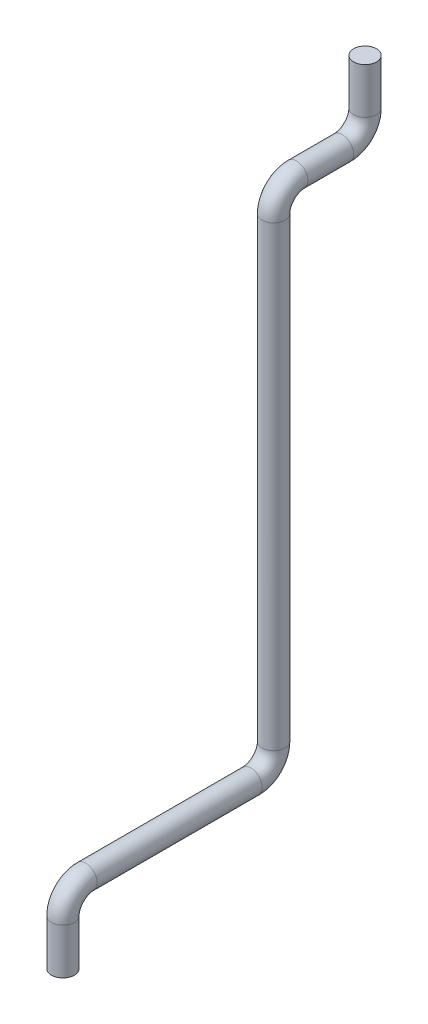
from build123d import *

# Parameters (mm, degrees)
SKETCH2_R = 0.5


with BuildPart() as part:
    # Sweep1: sweep along a path in Sketch1
    with BuildLine(Plane(origin=(0, 0, 0), x_dir=(0, 0, -1), z_dir=(1, 0, 0))) as sweep1_path:
        Line((0, 0), (0, 2))
        ThreePointArc((0, 2), (0.292893219, 2.707106781), (1, 3))
        Line((1, 3), (8.22, 3))
        ThreePointArc((8.22, 3), (8.927106781, 3.292893219), (9.22, 4))
        Line((9.22, 4), (9.22, 24))
        ThreePointArc((9.22, 24), (9.512893219, 24.707106781), (10.22, 25))
        Line((10.22, 25), (12.22, 25))
        ThreePointArc((12.22, 25), (12.927106781, 25.292893219), (13.22, 26))
        Line((13.22, 26), (13.22, 28))
    # Sketch2 → Sweep1 (sweep)
    with BuildSketch(Plane(origin=(0, 0, 0), x_dir=(1, 0, 0), z_dir=(0, 1, 0))):
        Circle(SKETCH2_R)
    sweep(path=sweep1_path.line)


solid = part.part
